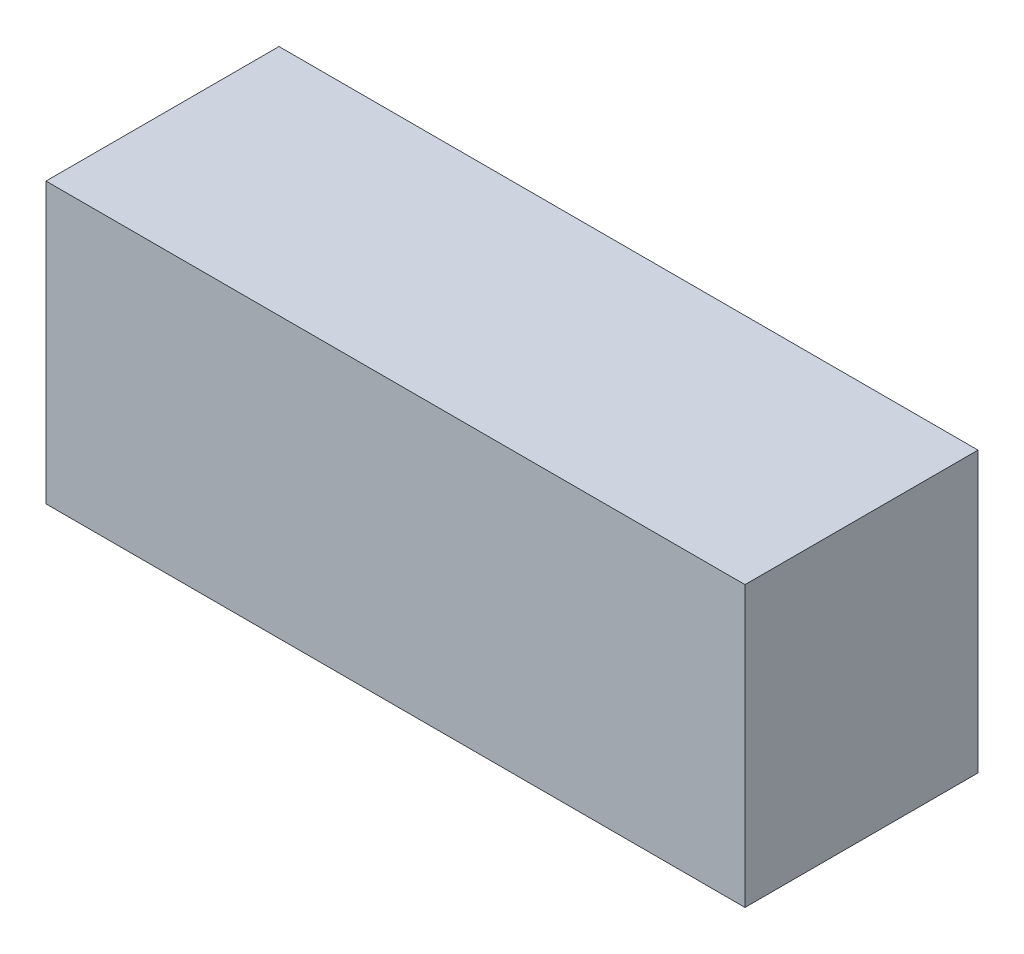
from build123d import *

# Parameters (mm, degrees)
SKETCH1_W           = 38.1
SKETCH1_H           = 12.7
BOSS_EXTRUDE1_DEPTH = 15.24


with BuildPart() as part:
    # Sketch1 → Boss-Extrude1 (new body)
    with BuildSketch(Plane(origin=(0, 0, 0), x_dir=(1, 0, 0), z_dir=(0, 1, 0))):
        Rectangle(SKETCH1_W, SKETCH1_H)
    extrude(amount=BOSS_EXTRUDE1_DEPTH)


solid = part.part
